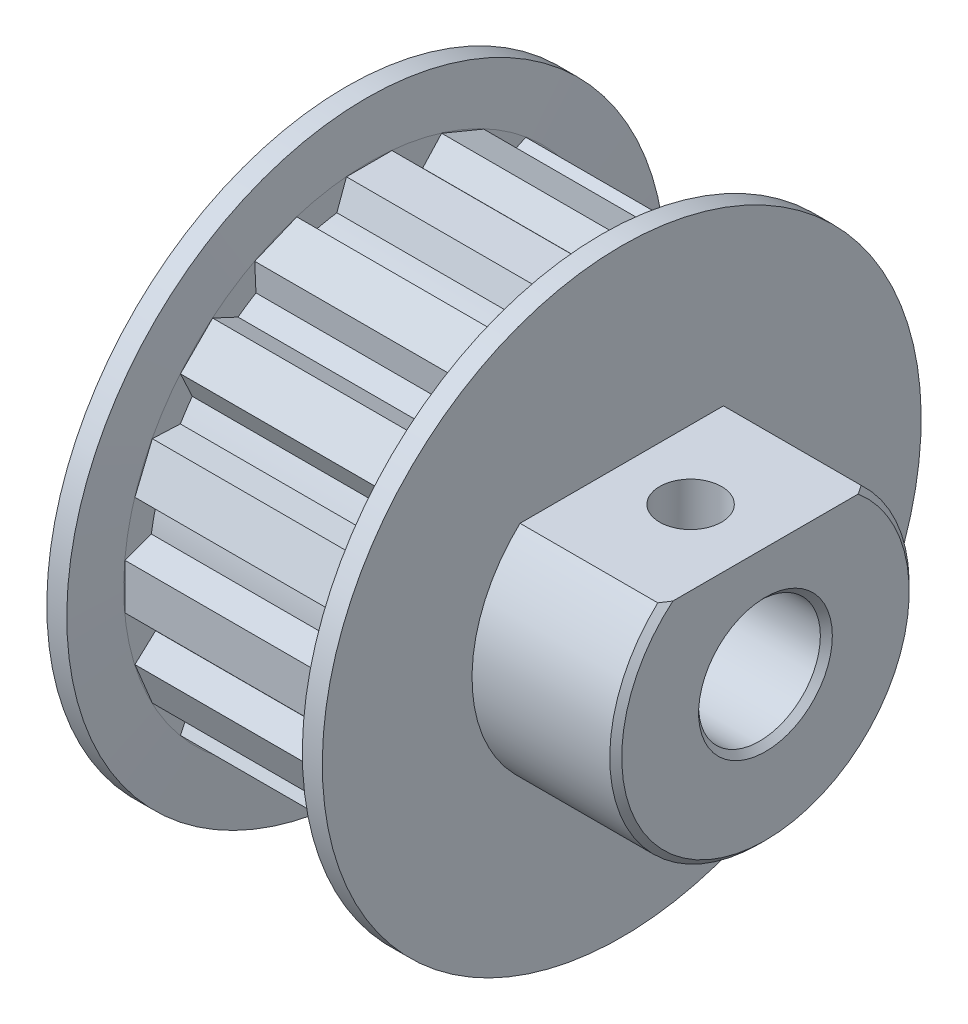
from build123d import *

# Parameters (mm, degrees)
SKETCH2_R                = 7.5
BOSS_EXTRUDE1_DEPTH      = 7.2
F_6_0_6_DIAMETER_HOLE1_D = 6.1
RIB1_REACH               = 31.85
SKETCH5_WALL_W           = 73.199246226
SKETCH5_WALL_H           = 2.28033022
RIB1_DRAFT_ANGLE         = 20
RIB2_REACH               = 31.85
SKETCH6_WALL_W           = 73.199246226
SKETCH6_WALL_H           = 2.28033022
RIB2_DRAFT_ANGLE         = 20
RIB3_REACH               = 31.85
SKETCH7_WALL_W           = 73.199246226
SKETCH7_WALL_H           = 2.28033022
RIB3_DRAFT_ANGLE         = 20
RIB4_REACH               = 31.85
SKETCH8_WALL_W           = 73.199246226
SKETCH8_WALL_H           = 2.28033022
RIB4_DRAFT_ANGLE         = 20
RIB5_REACH               = 31.85
SKETCH9_WALL_W           = 73.199246226
SKETCH9_WALL_H           = 2.28033022
RIB5_DRAFT_ANGLE         = 20
RIB6_REACH               = 31.85
SKETCH10_WALL_W          = 73.199246226
SKETCH10_WALL_H          = 2.28033022
RIB6_DRAFT_ANGLE         = 20
RIB7_REACH               = 31.85
SKETCH11_WALL_W          = 73.199246226
SKETCH11_WALL_H          = 2.28033022
RIB7_DRAFT_ANGLE         = 20
RIB8_REACH               = 31.85
SKETCH12_WALL_W          = 73.199246226
SKETCH12_WALL_H          = 2.28033022
RIB8_DRAFT_ANGLE         = 20
RIB9_REACH               = 31.85
SKETCH13_WALL_W          = 73.199246226
SKETCH13_WALL_H          = 2.28033022
RIB9_DRAFT_ANGLE         = 20
RIB10_REACH              = 31.85
SKETCH14_WALL_W          = 73.199246226
SKETCH14_WALL_H          = 2.28033022
RIB10_DRAFT_ANGLE        = 20
RIB11_REACH              = 31.85
SKETCH15_WALL_W          = 73.199246226
SKETCH15_WALL_H          = 2.28033022
RIB11_DRAFT_ANGLE        = 20
RIB12_REACH              = 31.85
SKETCH16_WALL_W          = 73.199246226
SKETCH16_WALL_H          = 2.28033022
RIB12_DRAFT_ANGLE        = 20
RIB13_REACH              = 31.85
SKETCH17_WALL_W          = 73.199246226
SKETCH17_WALL_H          = 2.28033022
RIB13_DRAFT_ANGLE        = 20
RIB14_REACH              = 31.85
SKETCH18_WALL_W          = 73.199246226
SKETCH18_WALL_H          = 2.28033022
RIB14_DRAFT_ANGLE        = 20
RIB15_REACH              = 31.85
SKETCH19_WALL_W          = 73.199246226
SKETCH19_WALL_H          = 2.28033022
RIB15_DRAFT_ANGLE        = 20
RIB16_REACH              = 31.85
SKETCH20_WALL_W          = 73.199246226
SKETCH20_WALL_H          = 2.28033022
RIB16_DRAFT_ANGLE        = 20
CHAMFER1_SIZE            = 0.3
SKETCH21_W               = 10.190038524
SKETCH21_H               = 2.367326759
CUT_EXTRUDE1_DEPTH       = 7.2
SKETCH22_R               = 1.55
CUT_EXTRUDE2_DEPTH       = 5.2


with BuildPart() as part:
    # Sketch1 → Revolve1 (revolve)
    with BuildSketch(Plane.XY):
        Polygon((0, 15), (0, 0), (13.8, 0), (13.8, 15), (12.8, 15), (12.65, 12.3), (12.65, 11.032395447), (1.15, 11.032395447), (1.15, 12.3), (1, 15), align=None)
    revolve(axis=Axis((0, 0, 0), (1, 0, 0)))

    # Sketch2 → Boss-Extrude1 (add)
    with BuildSketch(Plane(origin=(13.8, 0, 0), x_dir=(0, 0, -1), z_dir=(1, 0, 0))):
        Circle(SKETCH2_R)
    extrude(amount=BOSS_EXTRUDE1_DEPTH)

    # Ø6.0 (6) Diameter Hole1 (through all)
    with Locations(Plane(origin=(21, 0, 0), x_dir=(0, 0, -1), z_dir=(1, 0, 0))):
        with Locations((0, 0)):
            Hole(F_6_0_6_DIAMETER_HOLE1_D / 2)

    # Sketch5 wall → Rib1 (add, up to next)
    with BuildSketch(Plane(origin=(6.9, 0, 12.232395447), x_dir=(-1, 0, 0), z_dir=(0, 0, -1)), mode=Mode.PRIVATE) as rib1_sk1:
        Rectangle(SKETCH5_WALL_W, SKETCH5_WALL_H)
    rib1_tool1 = extrude(rib1_sk1.sketch, amount=RIB1_REACH, mode=Mode.PRIVATE) - part.part
    add(rib1_tool1.solids().sort_by_distance((6.9, 0, 12.232395447))[0])

    # Rib1 draft
    rib1_draft_faces = [part.faces().sort_by_distance(p)[0] for p in [
        (6.9, 1.14016511, 11.732395447),
        (6.9, -1.14016511, 11.732395447),
    ]]
    draft(rib1_draft_faces, Plane(origin=(6.9, 0, 12.232395447), x_dir=(-1, 0, 0), z_dir=(0, 0, 1)), RIB1_DRAFT_ANGLE)

    # Sketch6 wall → Rib2 (add, up to next)
    with BuildSketch(Plane(origin=(6.9, -12.232395447, 0), x_dir=(-1, 0, 0), z_dir=(0, 1, 0)), mode=Mode.PRIVATE) as rib2_sk1:
        Rectangle(SKETCH6_WALL_W, SKETCH6_WALL_H)
    rib2_tool1 = extrude(rib2_sk1.sketch, amount=RIB2_REACH, mode=Mode.PRIVATE) - part.part
    add(rib2_tool1.solids().sort_by_distance((6.9, -12.232395447, 0))[0])

    # Rib2 draft
    rib2_draft_faces = [part.faces().sort_by_distance(p)[0] for p in [
        (6.9, -11.732395447, 1.14016511),
        (6.9, -11.732395447, -1.14016511),
    ]]
    draft(rib2_draft_faces, Plane(origin=(6.9, -12.232395447, 0), x_dir=(-1, 0, 0), z_dir=(0, -1, 0)), RIB2_DRAFT_ANGLE)

    # Sketch7 wall → Rib3 (add, up to next)
    with BuildSketch(Plane(origin=(6.9, 0, -12.232395447), x_dir=(-1, 0, 0), z_dir=(0, 0, 1)), mode=Mode.PRIVATE) as rib3_sk1:
        Rectangle(SKETCH7_WALL_W, SKETCH7_WALL_H)
    rib3_tool1 = extrude(rib3_sk1.sketch, amount=RIB3_REACH, mode=Mode.PRIVATE) - part.part
    add(rib3_tool1.solids().sort_by_distance((6.9, 0, -12.232395447))[0])

    # Rib3 draft
    rib3_draft_faces = [part.faces().sort_by_distance(p)[0] for p in [
        (6.9, -1.14016511, -11.732395447),
        (6.9, 1.14016511, -11.732395447),
    ]]
    draft(rib3_draft_faces, Plane(origin=(6.9, 0, -12.232395447), x_dir=(-1, 0, 0), z_dir=(0, 0, -1)), RIB3_DRAFT_ANGLE)

    # Sketch8 wall → Rib4 (add, up to next)
    with BuildSketch(Plane(origin=(6.9, 12.232395447, 0), x_dir=(-1, 0, 0), z_dir=(0, -1, 0)), mode=Mode.PRIVATE) as rib4_sk1:
        Rectangle(SKETCH8_WALL_W, SKETCH8_WALL_H)
    rib4_tool1 = extrude(rib4_sk1.sketch, amount=RIB4_REACH, mode=Mode.PRIVATE) - part.part
    add(rib4_tool1.solids().sort_by_distance((6.9, 12.232395447, 0))[0])

    # Rib4 draft
    rib4_draft_faces = [part.faces().sort_by_distance(p)[0] for p in [
        (6.9, 11.732395447, -1.14016511),
        (6.9, 11.732395447, 1.14016511),
    ]]
    draft(rib4_draft_faces, Plane(origin=(6.9, 12.232395447, 0), x_dir=(-1, 0, 0), z_dir=(0, 1, 0)), RIB4_DRAFT_ANGLE)

    # Sketch9 wall → Rib5 (add, up to next)
    with BuildSketch(Plane(origin=(6.9, -4.681135076, 11.301259787), x_dir=(-1, 0, 0), z_dir=(0, 0.382683432365, -0.923879532511)), mode=Mode.PRIVATE) as rib5_sk1:
        Rectangle(SKETCH9_WALL_W, SKETCH9_WALL_H)
    rib5_tool1 = extrude(rib5_sk1.sketch, amount=RIB5_REACH, mode=Mode.PRIVATE) - part.part
    add(rib5_tool1.solids().sort_by_distance((6.9, -4.681135076, 11.301259787))[0])

    # Rib5 draft
    rib5_draft_faces = [part.faces().sort_by_distance(p)[0] for p in [
        (6.9, -3.436418151, 11.275642318),
        (6.9, -5.543168569, 10.402997723),
    ]]
    draft(rib5_draft_faces, Plane(origin=(6.9, -4.681135076, 11.301259787), x_dir=(-1, 0, 0), z_dir=(0, -0.382683432365, 0.923879532511)), RIB5_DRAFT_ANGLE)

    # Sketch10 wall → Rib6 (add, up to next)
    with BuildSketch(Plane(origin=(6.9, -4.681135076, -11.301259787), x_dir=(-1, 0, 0), z_dir=(0, 0.382683432365, 0.923879532511)), mode=Mode.PRIVATE) as rib6_sk1:
        Rectangle(SKETCH10_WALL_W, SKETCH10_WALL_H)
    rib6_tool1 = extrude(rib6_sk1.sketch, amount=RIB6_REACH, mode=Mode.PRIVATE) - part.part
    add(rib6_tool1.solids().sort_by_distance((6.9, -4.681135076, -11.301259787))[0])

    # Rib6 draft
    rib6_draft_faces = [part.faces().sort_by_distance(p)[0] for p in [
        (6.9, -5.543168569, -10.402997723),
        (6.9, -3.436418151, -11.275642318),
    ]]
    draft(rib6_draft_faces, Plane(origin=(6.9, -4.681135076, -11.301259787), x_dir=(-1, 0, 0), z_dir=(0, -0.382683432365, -0.923879532511)), RIB6_DRAFT_ANGLE)

    # Sketch11 wall → Rib7 (add, up to next)
    with BuildSketch(Plane(origin=(6.9, -11.301259787, 4.681135076), x_dir=(-1, 0, 0), z_dir=(0, 0.923879532511, -0.382683432365)), mode=Mode.PRIVATE) as rib7_sk1:
        Rectangle(SKETCH11_WALL_W, SKETCH11_WALL_H)
    rib7_tool1 = extrude(rib7_sk1.sketch, amount=RIB7_REACH, mode=Mode.PRIVATE) - part.part
    add(rib7_tool1.solids().sort_by_distance((6.9, -11.301259787, 4.681135076))[0])

    # Rib7 draft
    rib7_draft_faces = [part.faces().sort_by_distance(p)[0] for p in [
        (6.9, -10.402997723, 5.543168569),
        (6.9, -11.275642318, 3.436418151),
    ]]
    draft(rib7_draft_faces, Plane(origin=(6.9, -11.301259787, 4.681135076), x_dir=(-1, 0, 0), z_dir=(0, -0.923879532511, 0.382683432365)), RIB7_DRAFT_ANGLE)

    # Sketch12 wall → Rib8 (add, up to next)
    with BuildSketch(Plane(origin=(6.9, -8.649609771, -8.649609771), x_dir=(-1, 0, 0), z_dir=(0, 0.707106781187, 0.707106781187)), mode=Mode.PRIVATE) as rib8_sk1:
        Rectangle(SKETCH12_WALL_W, SKETCH12_WALL_H)
    rib8_tool1 = extrude(rib8_sk1.sketch, amount=RIB8_REACH, mode=Mode.PRIVATE) - part.part
    add(rib8_tool1.solids().sort_by_distance((6.9, -8.649609771, -8.649609771))[0])

    # Rib8 draft
    rib8_draft_faces = [part.faces().sort_by_distance(p)[0] for p in [
        (6.9, -9.102274861, -7.4898379),
        (6.9, -7.4898379, -9.102274861),
    ]]
    draft(rib8_draft_faces, Plane(origin=(6.9, -8.649609771, -8.649609771), x_dir=(-1, 0, 0), z_dir=(0, -0.707106781187, -0.707106781187)), RIB8_DRAFT_ANGLE)

    # Sketch13 wall → Rib9 (add, up to next)
    with BuildSketch(Plane(origin=(6.9, 8.649609771, 8.649609771), x_dir=(-1, 0, 0), z_dir=(0, -0.707106781187, -0.707106781187)), mode=Mode.PRIVATE) as rib9_sk1:
        Rectangle(SKETCH13_WALL_W, SKETCH13_WALL_H)
    rib9_tool1 = extrude(rib9_sk1.sketch, amount=RIB9_REACH, mode=Mode.PRIVATE) - part.part
    add(rib9_tool1.solids().sort_by_distance((6.9, 8.649609771, 8.649609771))[0])

    # Rib9 draft
    rib9_draft_faces = [part.faces().sort_by_distance(p)[0] for p in [
        (6.9, 9.102274861, 7.4898379),
        (6.9, 7.4898379, 9.102274861),
    ]]
    draft(rib9_draft_faces, Plane(origin=(6.9, 8.649609771, 8.649609771), x_dir=(-1, 0, 0), z_dir=(0, 0.707106781187, 0.707106781187)), RIB9_DRAFT_ANGLE)

    # Sketch14 wall → Rib10 (add, up to next)
    with BuildSketch(Plane(origin=(6.9, -11.301259787, -4.681135076), x_dir=(-1, 0, 0), z_dir=(0, 0.923879532511, 0.382683432365)), mode=Mode.PRIVATE) as rib10_sk1:
        Rectangle(SKETCH14_WALL_W, SKETCH14_WALL_H)
    rib10_tool1 = extrude(rib10_sk1.sketch, amount=RIB10_REACH, mode=Mode.PRIVATE) - part.part
    add(rib10_tool1.solids().sort_by_distance((6.9, -11.301259787, -4.681135076))[0])

    # Rib10 draft
    rib10_draft_faces = [part.faces().sort_by_distance(p)[0] for p in [
        (6.9, -11.275642318, -3.436418151),
        (6.9, -10.402997723, -5.543168569),
    ]]
    draft(rib10_draft_faces, Plane(origin=(6.9, -11.301259787, -4.681135076), x_dir=(-1, 0, 0), z_dir=(0, -0.923879532511, -0.382683432365)), RIB10_DRAFT_ANGLE)

    # Sketch15 wall → Rib11 (add, up to next)
    with BuildSketch(Plane(origin=(6.9, -8.649609771, 8.649609771), x_dir=(-1, 0, 0), z_dir=(0, 0.707106781187, -0.707106781187)), mode=Mode.PRIVATE) as rib11_sk1:
        Rectangle(SKETCH15_WALL_W, SKETCH15_WALL_H)
    rib11_tool1 = extrude(rib11_sk1.sketch, amount=RIB11_REACH, mode=Mode.PRIVATE) - part.part
    add(rib11_tool1.solids().sort_by_distance((6.9, -8.649609771, 8.649609771))[0])

    # Rib11 draft
    rib11_draft_faces = [part.faces().sort_by_distance(p)[0] for p in [
        (6.9, -7.4898379, 9.102274861),
        (6.9, -9.102274861, 7.4898379),
    ]]
    draft(rib11_draft_faces, Plane(origin=(6.9, -8.649609771, 8.649609771), x_dir=(-1, 0, 0), z_dir=(0, -0.707106781187, 0.707106781187)), RIB11_DRAFT_ANGLE)

    # Sketch16 wall → Rib12 (add, up to next)
    with BuildSketch(Plane(origin=(6.9, 8.649609771, -8.649609771), x_dir=(-1, 0, 0), z_dir=(0, -0.707106781187, 0.707106781187)), mode=Mode.PRIVATE) as rib12_sk1:
        Rectangle(SKETCH16_WALL_W, SKETCH16_WALL_H)
    rib12_tool1 = extrude(rib12_sk1.sketch, amount=RIB12_REACH, mode=Mode.PRIVATE) - part.part
    add(rib12_tool1.solids().sort_by_distance((6.9, 8.649609771, -8.649609771))[0])

    # Rib12 draft
    rib12_draft_faces = [part.faces().sort_by_distance(p)[0] for p in [
        (6.9, 7.4898379, -9.102274861),
        (6.9, 9.102274861, -7.4898379),
    ]]
    draft(rib12_draft_faces, Plane(origin=(6.9, 8.649609771, -8.649609771), x_dir=(-1, 0, 0), z_dir=(0, 0.707106781187, -0.707106781187)), RIB12_DRAFT_ANGLE)

    # Sketch17 wall → Rib13 (add, up to next)
    with BuildSketch(Plane(origin=(6.9, 4.681135076, -11.301259787), x_dir=(-1, 0, 0), z_dir=(0, -0.382683432365, 0.923879532511)), mode=Mode.PRIVATE) as rib13_sk1:
        Rectangle(SKETCH17_WALL_W, SKETCH17_WALL_H)
    rib13_tool1 = extrude(rib13_sk1.sketch, amount=RIB13_REACH, mode=Mode.PRIVATE) - part.part
    add(rib13_tool1.solids().sort_by_distance((6.9, 4.681135076, -11.301259787))[0])

    # Rib13 draft
    rib13_draft_faces = [part.faces().sort_by_distance(p)[0] for p in [
        (6.9, 3.436418151, -11.275642318),
        (6.9, 5.543168569, -10.402997723),
    ]]
    draft(rib13_draft_faces, Plane(origin=(6.9, 4.681135076, -11.301259787), x_dir=(-1, 0, 0), z_dir=(0, 0.382683432365, -0.923879532511)), RIB13_DRAFT_ANGLE)

    # Sketch18 wall → Rib14 (add, up to next)
    with BuildSketch(Plane(origin=(6.9, 11.301259787, 4.681135076), x_dir=(-1, 0, 0), z_dir=(0, -0.923879532511, -0.382683432365)), mode=Mode.PRIVATE) as rib14_sk1:
        Rectangle(SKETCH18_WALL_W, SKETCH18_WALL_H)
    rib14_tool1 = extrude(rib14_sk1.sketch, amount=RIB14_REACH, mode=Mode.PRIVATE) - part.part
    add(rib14_tool1.solids().sort_by_distance((6.9, 11.301259787, 4.681135076))[0])

    # Rib14 draft
    rib14_draft_faces = [part.faces().sort_by_distance(p)[0] for p in [
        (6.9, 11.275642318, 3.436418151),
        (6.9, 10.402997723, 5.543168569),
    ]]
    draft(rib14_draft_faces, Plane(origin=(6.9, 11.301259787, 4.681135076), x_dir=(-1, 0, 0), z_dir=(0, 0.923879532511, 0.382683432365)), RIB14_DRAFT_ANGLE)

    # Sketch19 wall → Rib15 (add, up to next)
    with BuildSketch(Plane(origin=(6.9, 11.301259787, -4.681135076), x_dir=(-1, 0, 0), z_dir=(0, -0.923879532511, 0.382683432365)), mode=Mode.PRIVATE) as rib15_sk1:
        Rectangle(SKETCH19_WALL_W, SKETCH19_WALL_H)
    rib15_tool1 = extrude(rib15_sk1.sketch, amount=RIB15_REACH, mode=Mode.PRIVATE) - part.part
    add(rib15_tool1.solids().sort_by_distance((6.9, 11.301259787, -4.681135076))[0])

    # Rib15 draft
    rib15_draft_faces = [part.faces().sort_by_distance(p)[0] for p in [
        (6.9, 10.402997723, -5.543168569),
        (6.9, 11.275642318, -3.436418151),
    ]]
    draft(rib15_draft_faces, Plane(origin=(6.9, 11.301259787, -4.681135076), x_dir=(-1, 0, 0), z_dir=(0, 0.923879532511, -0.382683432365)), RIB15_DRAFT_ANGLE)

    # Sketch20 wall → Rib16 (add, up to next)
    with BuildSketch(Plane(origin=(6.9, 4.681135076, 11.301259787), x_dir=(-1, 0, 0), z_dir=(0, -0.382683432365, -0.923879532511)), mode=Mode.PRIVATE) as rib16_sk1:
        Rectangle(SKETCH20_WALL_W, SKETCH20_WALL_H)
    rib16_tool1 = extrude(rib16_sk1.sketch, amount=RIB16_REACH, mode=Mode.PRIVATE) - part.part
    add(rib16_tool1.solids().sort_by_distance((6.9, 4.681135076, 11.301259787))[0])

    # Rib16 draft
    rib16_draft_faces = [part.faces().sort_by_distance(p)[0] for p in [
        (6.9, 5.543168569, 10.402997723),
        (6.9, 3.436418151, 11.275642318),
    ]]
    draft(rib16_draft_faces, Plane(origin=(6.9, 4.681135076, 11.301259787), x_dir=(-1, 0, 0), z_dir=(0, 0.382683432365, 0.923879532511)), RIB16_DRAFT_ANGLE)

    # Chamfer1
    chamfer1_edges = [part.edges().sort_by_distance(p)[0] for p in [
        (21, 0, 7.5),
        (21, 0, -3.05),
        (0, 0, -3.05),
    ]]
    chamfer(chamfer1_edges, length=CHAMFER1_SIZE)

    # Sketch21 → Cut-Extrude1 (cut)
    with BuildSketch(Plane(origin=(21, 0, 0), x_dir=(0, 0, -1), z_dir=(1, 0, 0))):
        with Locations((0, 6.687369288)):
            Rectangle(SKETCH21_W, SKETCH21_H)
    extrude(amount=-CUT_EXTRUDE1_DEPTH, mode=Mode.SUBTRACT)

    # Sketch22 → Cut-Extrude2 (cut)
    with BuildSketch(Plane(origin=(0, 5.503705908, 0), x_dir=(1, 0, 0), z_dir=(0, 1, 0))):
        with Locations(Location((17.25, 0, 0), (0, 0, 270))):
            Circle(SKETCH22_R)
    extrude(amount=-CUT_EXTRUDE2_DEPTH, mode=Mode.SUBTRACT)


solid = part.part
